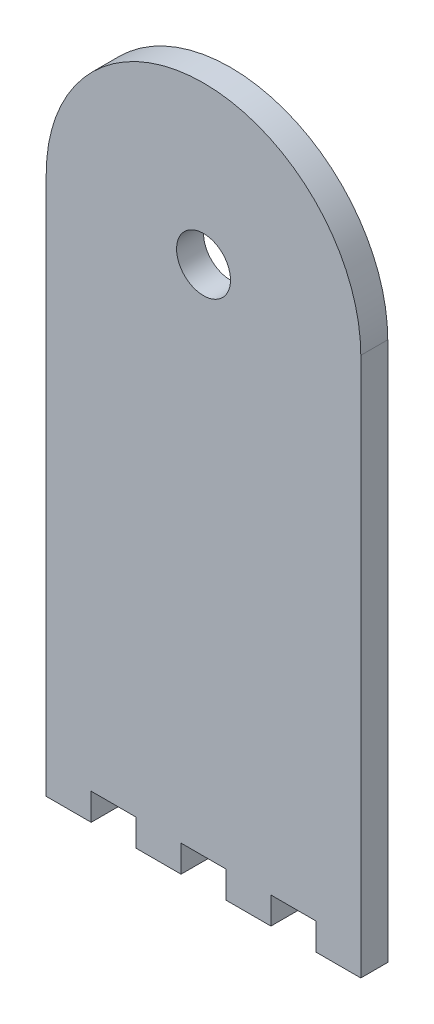
from build123d import *

# Parameters (mm, degrees)
CROQUIS1_R              = 3
SALIENTE_EXTRUIR1_DEPTH = 3


with BuildPart() as part:
    # Croquis1 → Saliente-Extruir1 (new body)
    with BuildSketch(Plane.XY):
        with BuildLine():
            Line((0, -60), (0, 0))
            ThreePointArc((0, 0), (17.5, 17.5), (35, 0))
            Line((35, 0), (35, -60))
            Line((35, -60), (30, -60))
            Line((30, -60), (30, -57))
            Line((30, -57), (25, -57))
            Line((25, -57), (25, -60))
            Line((25, -60), (20, -60))
            Line((20, -60), (20, -57))
            Line((20, -57), (15, -57))
            Line((15, -57), (15, -60))
            Line((15, -60), (10, -60))
            Line((10, -60), (10, -57))
            Line((10, -57), (5, -57))
            Line((5, -57), (5, -60))
            Line((5, -60), (0, -60))
        make_face()
        with Locations((17.5, 0)):
            Circle(CROQUIS1_R, mode=Mode.SUBTRACT)
    extrude(amount=SALIENTE_EXTRUIR1_DEPTH)


solid = part.part
